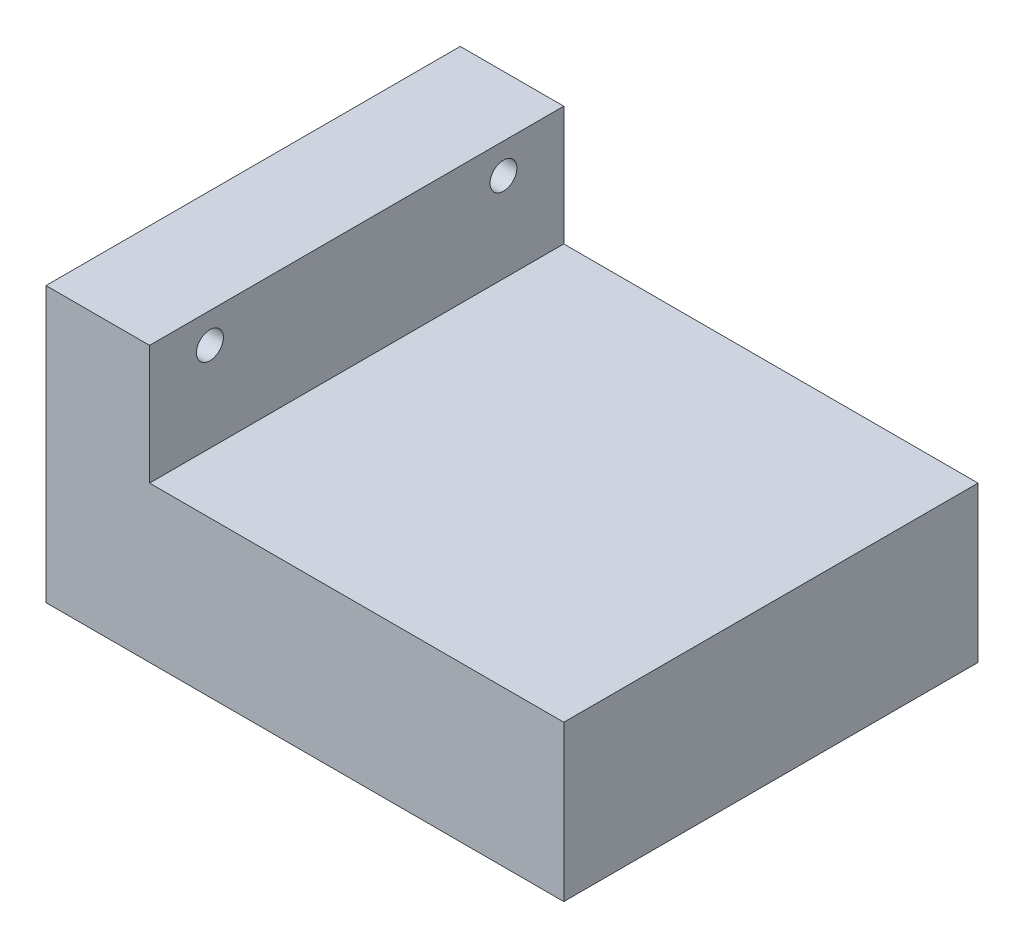
from build123d import *

# Parameters (mm, degrees)
SKETCH1_W             = 50.8
SKETCH1_H             = 50.8
BOSS_EXTRUDE1_DEPTH   = 19.05
SKETCH1_3_W           = 12.7
SKETCH1_3_H           = 50.8
BOSS_EXTRUDE2_DEPTH   = 33.6804
M4X0_7_TAPPED_HOLE1_D = 3.3


with BuildPart() as part:
    # Sketch1 → Boss-Extrude1 (new body)
    with BuildSketch(Plane(origin=(0, 0, 0), x_dir=(1, 0, 0), z_dir=(0, 1, 0))):
        with Locations((6.35, 0)):
            Rectangle(SKETCH1_W, SKETCH1_H)
    extrude(amount=BOSS_EXTRUDE1_DEPTH)

    # Sketch1<3> → Boss-Extrude2 (add)
    with BuildSketch(Plane(origin=(0, 0, 0), x_dir=(1, 0, 0), z_dir=(0, 1, 0))):
        with Locations((-25.4, 0)):
            Rectangle(SKETCH1_3_W, SKETCH1_3_H)
    extrude(amount=BOSS_EXTRUDE2_DEPTH)

    # M4x0.7 Tapped Hole1 (through all)
    with Locations(Plane.ZY.offset(31.75)):
        with Locations((18, 30), (-18, 30)):
            Hole(M4X0_7_TAPPED_HOLE1_D / 2)


solid = part.part
